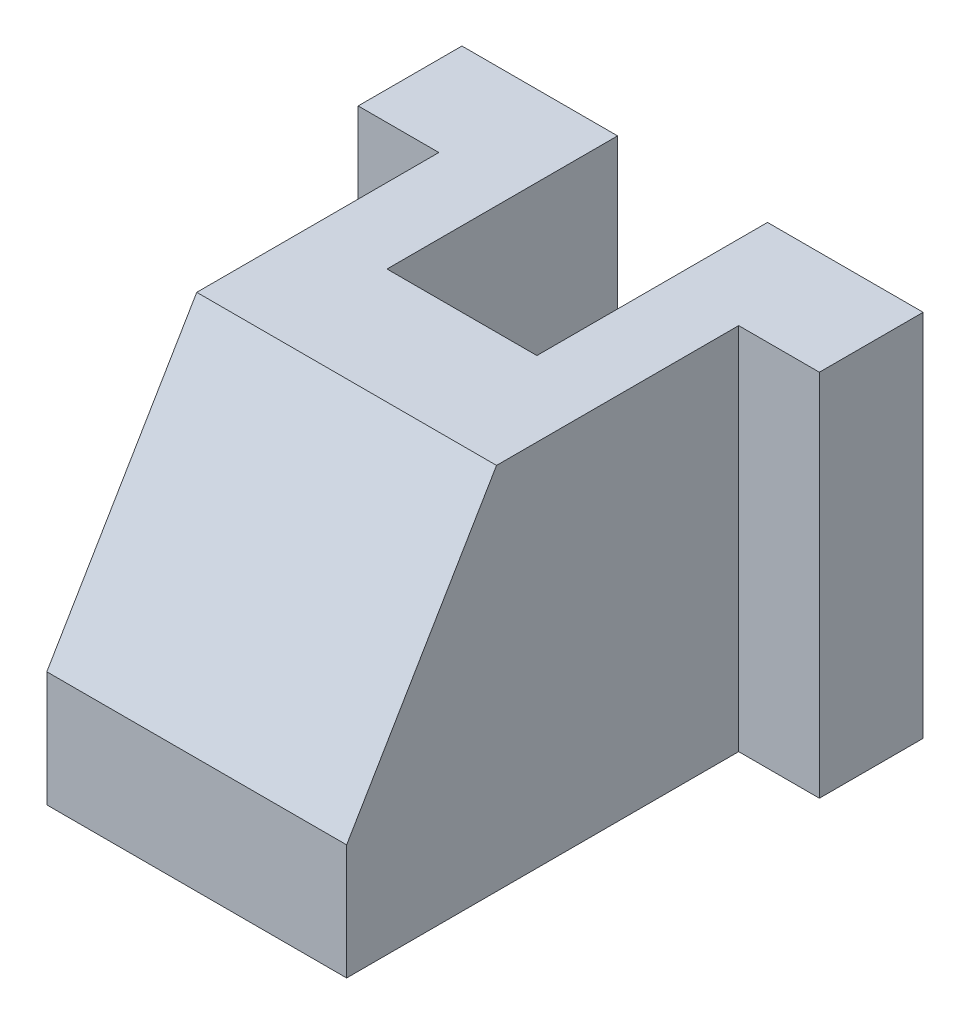
from build123d import *

# Parameters (mm, degrees)
BOSS_EXTRUDE2_DEPTH = 26
SKETCH2_W           = 9
SKETCH2_H           = 32
BOSS_EXTRUDE3_DEPTH = 7
SKETCH3_W           = 9
SKETCH3_H           = 32
BOSS_EXTRUDE4_DEPTH = 7
SKETCH4_W           = 13
SKETCH4_H           = 20
CUT_EXTRUDE2_DEPTH  = 34


with BuildPart() as part:
    # Sketch1 → Boss-Extrude2 (new body)
    with BuildSketch(Plane(origin=(0, 0, 0), x_dir=(0, 0, -1), z_dir=(1, 0, 0))):
        Polygon((-43, 0), (0, 0), (0, 32), (-30, 32), (-43, 10), align=None)
    extrude(amount=-BOSS_EXTRUDE2_DEPTH)

    # Sketch2 → Boss-Extrude3 (add)
    with BuildSketch(Plane(origin=(0, 0, 0), x_dir=(0, 0, -1), z_dir=(1, 0, 0))):
        with Locations((-4.5, 16)):
            Rectangle(SKETCH2_W, SKETCH2_H)
    extrude(amount=BOSS_EXTRUDE3_DEPTH)

    # Sketch3 → Boss-Extrude4 (add)
    with BuildSketch(Plane.ZY.offset(26)):
        with Locations((4.5, 16)):
            Rectangle(SKETCH3_W, SKETCH3_H)
    extrude(amount=BOSS_EXTRUDE4_DEPTH)

    # Sketch4 → Cut-Extrude2 (cut)
    with BuildSketch(Plane(origin=(0, 32, 0), x_dir=(1, 0, 0), z_dir=(0, 1, 0))):
        with Locations((-13, -10)):
            Rectangle(SKETCH4_W, SKETCH4_H)
    extrude(amount=-CUT_EXTRUDE2_DEPTH, mode=Mode.SUBTRACT)


solid = part.part
